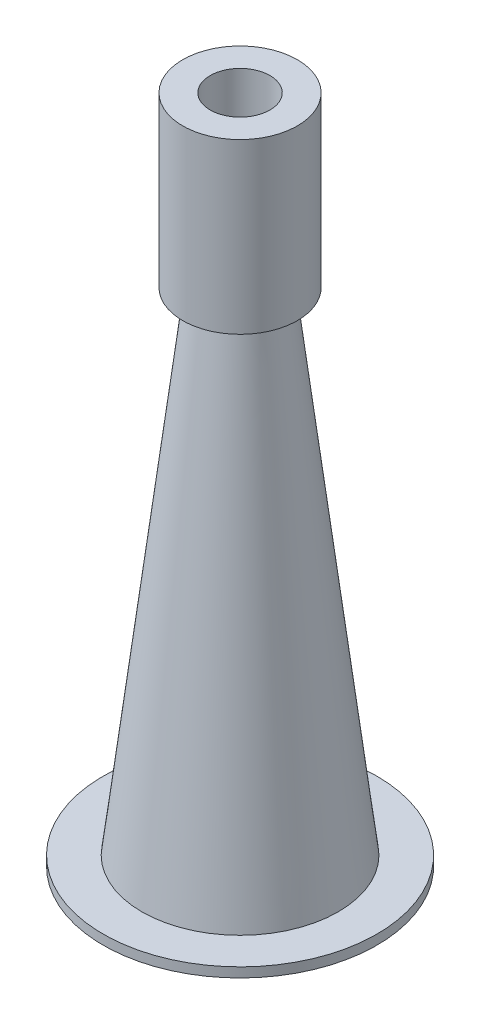
from build123d import *


with BuildPart() as part:
    # Sketch1 → Revolve2 (revolve)
    with BuildSketch(Plane.XY, mode=Mode.PRIVATE) as revolve2_sk:
        Polygon((31, 695), (59.5, 695), (59.5, 520), (41, 520), (101.908326061, 10), (142, 10), (142, 0), (95, 0), (31, 520), align=None)
    revolve(revolve2_sk.sketch.rotate(Axis((0, 0, 0), (0, 1, 0)), 90), axis=Axis((0, 0, 0), (0, 1, 0)))


solid = part.part
